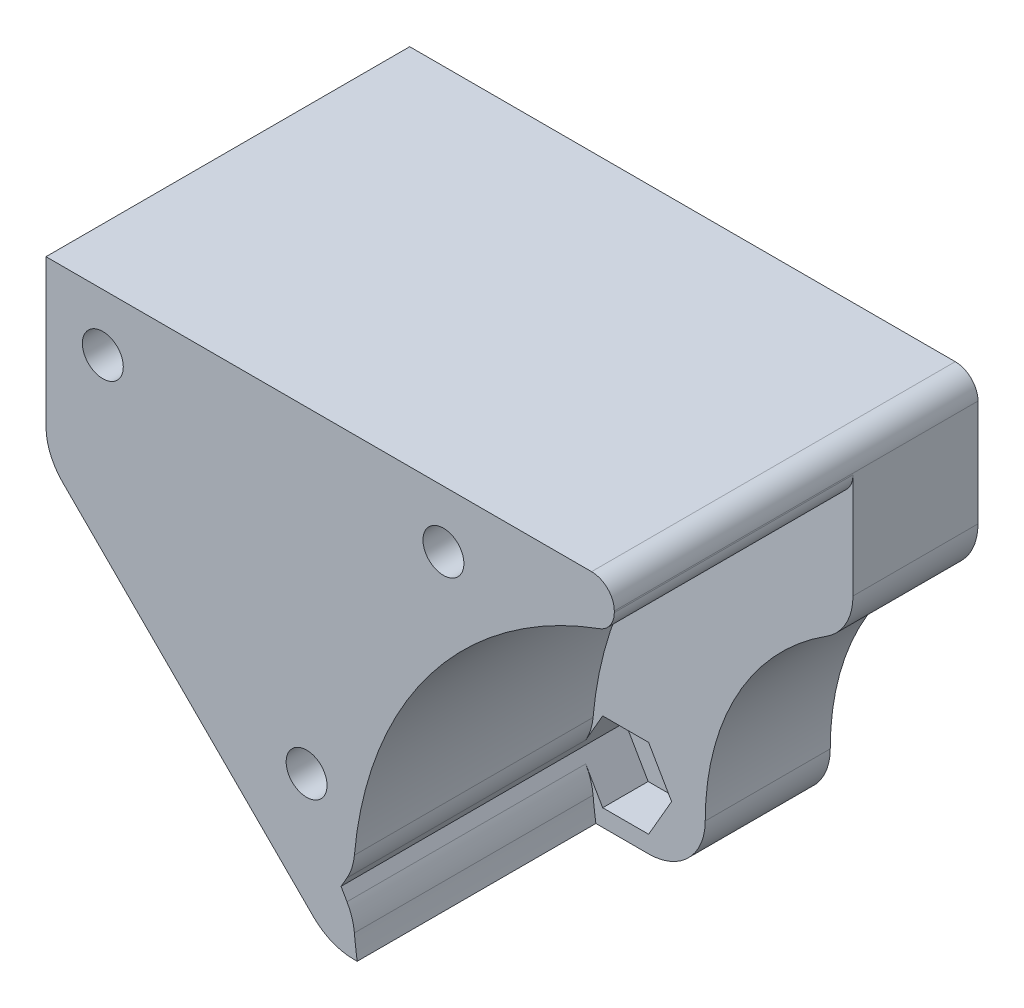
from build123d import *

# Parameters (mm, degrees)
SKETCH1_R           = 2.286
BOSS_EXTRUDE1_DEPTH = 40.64
SKETCH2_R           = 41.91
CUT_EXTRUDE1_DEPTH  = 26.67
SKETCH3_R           = 29.21
CUT_EXTRUDE2_DEPTH  = 91.909293254
SKETCH4_R           = 2.286
CUT_EXTRUDE3_DEPTH  = 91.909293254
CUT_EXTRUDE4_DEPTH  = 31.75
FILLET1_R           = 6.35
FILLET2_R           = 2.54
FILLET3_R           = 6.35


with BuildPart() as part:
    # Sketch1 → Boss-Extrude1 (new body)
    with BuildSketch(Plane.XY):
        Polygon((-63.5, 31.75), (-31.75, 0), (0, 0), (0, 50.8), (-63.5, 50.8), align=None)
        with Locations((-57.15, 44.45)):
            Circle(SKETCH1_R, mode=Mode.SUBTRACT)
        with Locations((-19.091771775, 44.45)):
            Circle(SKETCH1_R, mode=Mode.SUBTRACT)
        with Locations((-34.380256121, 15.330256121)):
            Circle(SKETCH1_R, mode=Mode.SUBTRACT)
    extrude(amount=BOSS_EXTRUDE1_DEPTH)

    # Sketch2 → Cut-Extrude1 (cut)
    with BuildSketch(Plane.XY.offset(40.64)):
        with Locations((12.7, 6.35)):
            Circle(SKETCH2_R)
    extrude(amount=-CUT_EXTRUDE1_DEPTH, mode=Mode.SUBTRACT)

    # Sketch3 → Cut-Extrude2 (cut, through all)
    with BuildSketch(Plane(origin=(0, 0, 0), x_dir=(-1, 0, 0), z_dir=(0, 0, -1))):
        with Locations((-12.7, 6.35)):
            Circle(SKETCH3_R)
    extrude(amount=-CUT_EXTRUDE2_DEPTH, mode=Mode.SUBTRACT)

    # Sketch4 → Cut-Extrude3 (cut, through all)
    with BuildSketch(Plane(origin=(0, 0, 0), x_dir=(-1, 0, 0), z_dir=(0, 0, -1))):
        with Locations((25.4, 6.35)):
            Circle(SKETCH4_R)
    extrude(amount=-CUT_EXTRUDE3_DEPTH, mode=Mode.SUBTRACT)

    # Sketch5 → Cut-Extrude4 (cut)
    with BuildSketch(Plane.XY.offset(40.64)):
        Polygon((-20.267356107, 6.35), (-22.833678053, 10.795), (-27.966321947, 10.795), (-30.532643893, 6.35), (-27.966321947, 1.905), (-22.833678053, 1.905), align=None)
    extrude(amount=-CUT_EXTRUDE4_DEPTH, mode=Mode.SUBTRACT)

    # Fillet1
    fillet1_edges = [part.edges().sort_by_distance(p)[0] for p in [
        (0, 32.654640275, 6.985),
        (-15.811429287, 0, 6.985),
        (-31.75, 0, 20.32),
        (-63.5, 31.75, 20.32),
    ]]
    fillet(fillet1_edges, radius=FILLET1_R)

    # Fillet2
    fillet2_edges = [part.edges().sort_by_distance(p)[0] for p in [
        (0, 46.289430392, 27.305),
        (0, 50.8, 20.32),
    ]]
    fillet(fillet2_edges, radius=FILLET2_R)

    # Fillet3
    fillet3_edges = [part.edges().sort_by_distance(p)[0] for p in [
        (-29.140585836, 3.938884718, 27.305),
        (-29.140585836, 8.761115282, 27.305),
    ]]
    fillet(fillet3_edges, radius=FILLET3_R)


solid = part.part
